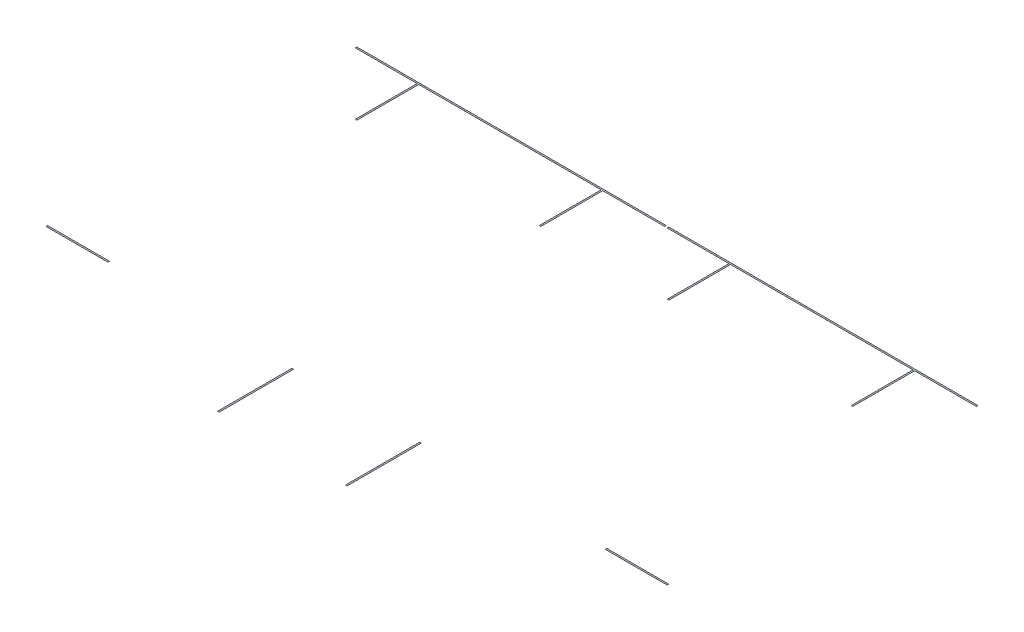
from build123d import *

# Parameters (mm, degrees)
EXTRUDE_1_DEPTH   = 0.2
SKETCH_1_W        = 1200
SKETCH_1_H        = 30
EXTRUDE_1_2_DEPTH = 0.2
SKETCH_1_W_2      = 30
SKETCH_1_H_2      = 1440
EXTRUDE_1_3_DEPTH = 0.2
EXTRUDE_1_4_DEPTH = 0.2
EXTRUDE_1_5_DEPTH = 0.2
EXTRUDE_1_6_DEPTH = 0.2


with BuildPart() as part:
    # 草图1 → 凸台-拉伸1 (new body)
    with BuildSketch(Plane(origin=(0, 0, 0), x_dir=(1, 0, 0), z_dir=(0, 1, 0))):
        Polygon((-6025, 0), (-25, 0), (-25, -30), (-1225, -30), (-1225, -1230), (-1255, -1230), (-1255, -30), (-4795, -30), (-4795, -1230), (-4825, -1230), (-4825, -30), (-6025, -30), align=None)
    extrude(amount=EXTRUDE_1_DEPTH)


with BuildPart() as body_2:
    # 草图1 → Extrude 1 2 (new body)
    with BuildSketch(Plane(origin=(0, 0, 0), x_dir=(1, 0, 0), z_dir=(0, 1, 0))):
        with Locations((-5425, -6015)):
            Rectangle(SKETCH_1_W, SKETCH_1_H)
    extrude(amount=EXTRUDE_1_2_DEPTH)


with BuildPart() as body_3:
    # 草图1 → Extrude 1 3 (new body)
    with BuildSketch(Plane(origin=(0, 0, 0), x_dir=(1, 0, 0), z_dir=(0, 1, 0))):
        with Locations((-1240, -6750)):
            Rectangle(SKETCH_1_W_2, SKETCH_1_H_2)
    extrude(amount=EXTRUDE_1_3_DEPTH)


with BuildPart() as body_4:
    # 草图1 → Extrude 1 4 (new body)
    with BuildSketch(Plane(origin=(0, 0, 0), x_dir=(1, 0, 0), z_dir=(0, 1, 0))):
        with Locations((5425, -6015)):
            Rectangle(SKETCH_1_W, SKETCH_1_H)
    extrude(amount=EXTRUDE_1_4_DEPTH)


with BuildPart() as body_5:
    # 草图1 → Extrude 1 5 (new body)
    with BuildSketch(Plane(origin=(0, 0, 0), x_dir=(1, 0, 0), z_dir=(0, 1, 0))):
        with Locations((1240, -6750)):
            Rectangle(SKETCH_1_W_2, SKETCH_1_H_2)
    extrude(amount=EXTRUDE_1_5_DEPTH)


with BuildPart() as body_6:
    # 草图1 → Extrude 1 6 (new body)
    with BuildSketch(Plane(origin=(0, 0, 0), x_dir=(1, 0, 0), z_dir=(0, 1, 0))):
        Polygon((4825, -30), (6025, -30), (6025, 0), (25, 0), (25, -30), (1225, -30), (1225, -1230), (1255, -1230), (1255, -30), (4795, -30), (4795, -1230), (4825, -1230), align=None)
    extrude(amount=EXTRUDE_1_6_DEPTH)


solid = Compound([part.part, body_2.part, body_3.part, body_4.part, body_5.part, body_6.part])
